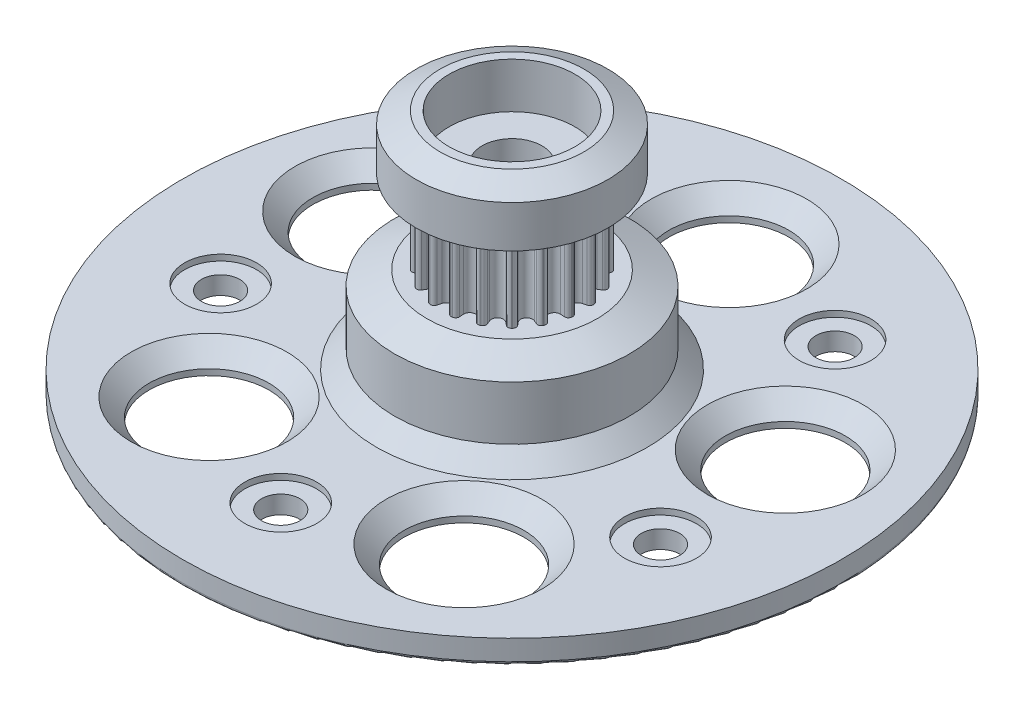
from build123d import *

# Parameters (mm, degrees)
SKETCH1_R                    = 27.5
BOSS_EXTRUDE1_DEPTH          = 2
SKETCH2_R                    = 9.8
BOSS_EXTRUDE2_DEPTH          = 6
CHAMFER1_SIZE                = 1.5
SKETCH3_R                    = 9.8
BOSS_EXTRUDE3_DEPTH          = 1.2
BOSS_EXTRUDE3_TAPER          = 66
SKETCH5_R                    = 6
BOSS_EXTRUDE4_DEPTH          = 6
CUT_EXTRUDE1_START           = -6
CUT_EXTRUDE1_DEPTH           = 6
CIRPATTERN1_COUNT            = 20
FILLET1_R                    = 0.3
SKETCH10_R                   = 5
CUT_EXTRUDE2_DEPTH           = 44.153099541
CHAMFER2_SIZE                = 1.5
SKETCH11_R                   = 1.6
CUT_EXTRUDE3_DEPTH           = 44.153099541
SKETCH12_R                   = 3
CUT_EXTRUDE4_DEPTH           = 0.5
CIRPATTERN2_COUNT            = 5
CHAMFER2_OF_CIRPATTERN2_SIZE = 1.5
SKETCH13_R                   = 8.2
CUT_EXTRUDE5_DEPTH           = 6.8
SKETCH15_W                   = 4.3
SKETCH15_H                   = 10.913122013
CUT_EXTRUDE6_DEPTH           = 1.8
CIRPATTERN3_COUNT            = 5
SKETCH16_R                   = 2.5
CUT_EXTRUDE7_DEPTH           = 9.9
FILLET2_R                    = 0.3


with BuildPart() as part:
    # Sketch1 → Boss-Extrude1 (new body)
    with BuildSketch(Plane(origin=(0, 0, 0), x_dir=(1, 0, 0), z_dir=(0, 1, 0))):
        with Locations(Location((0, 0, 0), (0, 0, 270))):
            Circle(SKETCH1_R)
    extrude(amount=BOSS_EXTRUDE1_DEPTH)

    # Sketch2 → Boss-Extrude2 (add)
    with BuildSketch(Plane(origin=(0, 2, 0), x_dir=(1, 0, 0), z_dir=(0, 1, 0))):
        with Locations(Location((0, 0, 0), (0, 0, 270))):
            Circle(SKETCH2_R)
    extrude(amount=BOSS_EXTRUDE2_DEPTH)

    # Chamfer1
    chamfer1_edges = [part.edges().sort_by_distance(p)[0] for p in [
        (0, 2, -9.8),
    ]]
    chamfer(chamfer1_edges, length=CHAMFER1_SIZE)

    # Sketch3 → Boss-Extrude3 (add)
    with BuildSketch(Plane(origin=(0, 8, 0), x_dir=(1, 0, 0), z_dir=(0, 1, 0))):
        with Locations(Location((0, 0, 0), (0, 0, 270))):
            Circle(SKETCH3_R)
    extrude(amount=BOSS_EXTRUDE3_DEPTH, taper=BOSS_EXTRUDE3_TAPER)

    # Sketch5 → Boss-Extrude4 (add)
    with BuildSketch(Plane(origin=(0, 9.2, 0), x_dir=(1, 0, 0), z_dir=(0, 1, 0))):
        with Locations(Location((0, 0, 0), (0, 0, 270))):
            Circle(SKETCH5_R)
    extrude(amount=BOSS_EXTRUDE4_DEPTH)

    # Sketch7 → Cut-Extrude1 (cut)
    with BuildSketch(Plane(origin=(0, 15.2, 0), x_dir=(1, 0, 0), z_dir=(0, 1, 0)).offset(CUT_EXTRUDE1_START)):
        with BuildLine():
            Line((-0.485147863, 5.379039052), (-0.631657739, 5.966658068))
            ThreePointArc((-0.631657739, 5.966658068), (0, 6), (0.631657739, 5.966658068))
            Line((0.631657739, 5.966658068), (0.485147863, 5.379039052))
            ThreePointArc((0.485147863, 5.379039052), (0, 5), (-0.485147863, 5.379039052))
        make_face()
    cut_extrude1 = extrude(amount=CUT_EXTRUDE1_DEPTH, mode=Mode.SUBTRACT)

    # CirPattern1: Cut-Extrude1 ×20 about axis
    cirpattern1_axis = Axis((0, 0, 0), (0, 1, 0))
    for i in range(1, CIRPATTERN1_COUNT):
        add(cut_extrude1.rotate(cirpattern1_axis, i * 360 / CIRPATTERN1_COUNT), mode=Mode.SUBTRACT)

    # Fillet1
    fillet1_edges = [part.edges().sort_by_distance(p)[0] for p in [
        (5.19840688, 12.2, 2.996091773),
        (4.455848673, 12.2, 4.018135463),
        (4.018135463, 12.2, 4.455848673),
        (2.996091773, 12.2, 5.19840688),
        (2.444540951, 12.2, 5.47943606),
        (1.243056534, 12.2, 5.869822012),
        (0.631657739, 12.2, 5.966658068),
        (-0.631657739, 12.2, 5.966658068),
        (-1.243056534, 12.2, 5.869822012),
        (-2.444540951, 12.2, 5.47943606),
        (-2.996091773, 12.2, 5.19840688),
        (-4.018135463, 12.2, 4.455848673),
        (-4.455848673, 12.2, 4.018135463),
        (-5.19840688, 12.2, 2.996091773),
        (-5.47943606, 12.2, 2.444540951),
        (-5.869822012, 12.2, 1.243056534),
        (-5.966658068, 12.2, 0.631657739),
        (-5.966658068, 12.2, -0.631657739),
        (-5.869822012, 12.2, -1.243056534),
        (-5.47943606, 12.2, -2.444540951),
        (-5.19840688, 12.2, -2.996091773),
        (-4.455848673, 12.2, -4.018135463),
        (-4.018135463, 12.2, -4.455848673),
        (-2.996091773, 12.2, -5.19840688),
        (-0.631657739, 12.2, -5.966658068),
        (0.631657739, 12.2, -5.966658068),
        (-2.444540951, 12.2, -5.47943606),
        (-1.243056534, 12.2, -5.869822012),
        (1.243056534, 12.2, -5.869822012),
        (2.444540951, 12.2, -5.47943606),
        (2.996091773, 12.2, -5.19840688),
        (4.018135463, 12.2, -4.455848673),
        (4.455848673, 12.2, -4.018135463),
        (5.19840688, 12.2, -2.996091773),
        (5.47943606, 12.2, -2.444540951),
        (5.869822012, 12.2, -1.243056534),
        (5.966658068, 12.2, -0.631657739),
        (5.966658068, 12.2, 0.631657739),
        (5.869822012, 12.2, 1.243056534),
        (5.47943606, 12.2, 2.444540951),
    ]]
    fillet(fillet1_edges, radius=FILLET1_R)

    # Sketch9 → Revolve1 (revolve)
    with BuildSketch(Plane(origin=(0, 0, 0), x_dir=(0, 0, -1), z_dir=(1, 0, 0)), mode=Mode.PRIVATE) as revolve1_sk:
        Polygon((0, 15.2), (6, 15.2), (8, 16.2), (8, 19.7), (6, 20.7), (5.25, 20.7), (5.25, 16.9), (0, 16.9), align=None)
    revolve(revolve1_sk.sketch.rotate(Axis((0, 16.9, 0), (0, -1, 0)), 180), axis=Axis((0, 16.9, 0), (0, -1, 0)))

    # Sketch10 → Cut-Extrude2 (cut, through all)
    with BuildSketch(Plane(origin=(0, 2, 0), x_dir=(1, 0, 0), z_dir=(0, 1, 0))):
        with Locations(Location((0, 18.1, 0), (0, 0, 270))):
            Circle(SKETCH10_R)
    cut_extrude2 = extrude(amount=-CUT_EXTRUDE2_DEPTH, mode=Mode.SUBTRACT)

    # Chamfer2
    chamfer2_edges = [part.edges().sort_by_distance(p)[0] for p in [
        (0, 2, -23.1),
    ]]
    chamfer(chamfer2_edges, length=CHAMFER2_SIZE)

    # Sketch11 → Cut-Extrude3 (cut, through all)
    with BuildSketch(Plane(origin=(0, 2, 0), x_dir=(1, 0, 0), z_dir=(0, 1, 0))):
        with Locations(Location((-11.344255369, 15.614027991, 0), (0, 0, 270))):
            Circle(SKETCH11_R)
    cut_extrude3 = extrude(amount=-CUT_EXTRUDE3_DEPTH, mode=Mode.SUBTRACT)

    # Sketch12 → Cut-Extrude4 (cut)
    with BuildSketch(Plane(origin=(0, 2, 0), x_dir=(1, 0, 0), z_dir=(0, 1, 0))):
        with Locations(Location((-11.344255369, 15.614027991, 0), (0, 0, 270))):
            Circle(SKETCH12_R)
    cut_extrude4 = extrude(amount=-CUT_EXTRUDE4_DEPTH, mode=Mode.SUBTRACT)

    # CirPattern2: Cut-Extrude2, Cut-Extrude3, Cut-Extrude4 ×5 about axis
    cirpattern2_axis = Axis((0, 0, 0), (0, 1, 0))
    add([cut_extrude2.rotate(cirpattern2_axis, i * 360 / CIRPATTERN2_COUNT) for i in range(1, CIRPATTERN2_COUNT)], mode=Mode.SUBTRACT)
    add([cut_extrude3.rotate(cirpattern2_axis, i * 360 / CIRPATTERN2_COUNT) for i in range(1, CIRPATTERN2_COUNT)], mode=Mode.SUBTRACT)
    add([cut_extrude4.rotate(cirpattern2_axis, i * 360 / CIRPATTERN2_COUNT) for i in range(1, CIRPATTERN2_COUNT)], mode=Mode.SUBTRACT)

    # Chamfer2 of CirPattern2
    chamfer2_of_cirpattern2_edges = [part.edges().sort_by_distance(p)[0] for p in [
        (-21.969405526, 2, -7.13829257),
        (-13.577839328, 2, 18.68829257),
        (13.577839328, 2, 18.68829257),
        (21.969405526, 2, -7.13829257),
    ]]
    chamfer(chamfer2_of_cirpattern2_edges, length=CHAMFER2_OF_CIRPATTERN2_SIZE)

    # Sketch13 → Cut-Extrude5 (cut)
    with BuildSketch(Plane.XZ):
        with Locations(Location((0, 0, 0), (0, 0, 270))):
            Circle(SKETCH13_R)
    extrude(amount=-CUT_EXTRUDE5_DEPTH, mode=Mode.SUBTRACT)

    # Sketch15 → Cut-Extrude6 (cut)
    with BuildSketch(Plane.XZ):
        with Locations((0, -5.456561007)):
            Rectangle(SKETCH15_W, SKETCH15_H)
    cut_extrude6 = extrude(amount=-CUT_EXTRUDE6_DEPTH, mode=Mode.SUBTRACT)

    # CirPattern3: Cut-Extrude6 ×5 about axis
    cirpattern3_axis = Axis((0, 0, 0), (0, 1, 0))
    for i in range(1, CIRPATTERN3_COUNT):
        add(cut_extrude6.rotate(cirpattern3_axis, i * 360 / CIRPATTERN3_COUNT), mode=Mode.SUBTRACT)

    # Sketch16 → Cut-Extrude7 (cut)
    with BuildSketch(Plane(origin=(0, 16.9, 0), x_dir=(1, 0, 0), z_dir=(0, 1, 0))):
        with Locations(Location((0, 0, 0), (0, 0, 270))):
            Circle(SKETCH16_R)
    extrude(amount=-CUT_EXTRUDE7_DEPTH, mode=Mode.SUBTRACT)

    # Fillet2
    fillet2_edges = [part.edges().sort_by_distance(p)[0] for p in [
        (0, 0, -27.5),
    ]]
    fillet(fillet2_edges, radius=FILLET2_R)


solid = part.part
